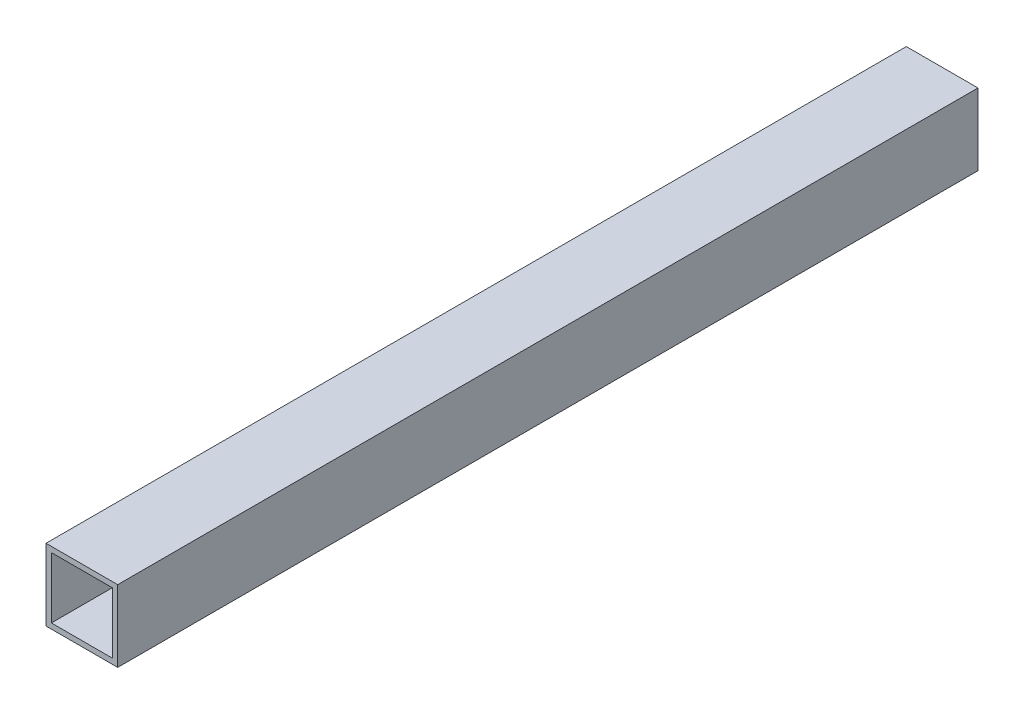
from build123d import *

# Parameters (mm, degrees)
SZKIC1_W                    = 20
SZKIC1_H                    = 20
SZKIC1_W_2                  = 17
SZKIC1_H_2                  = 17
DODANIE_WYCI_GNI_CIE1_DEPTH = 240


with BuildPart() as part:
    # Szkic1 → Dodanie-wyciągnięcie1 (new body)
    with BuildSketch(Plane.XY):
        Rectangle(SZKIC1_W, SZKIC1_H)
        Rectangle(SZKIC1_W_2, SZKIC1_H_2, mode=Mode.SUBTRACT)
    extrude(amount=DODANIE_WYCI_GNI_CIE1_DEPTH)


solid = part.part
